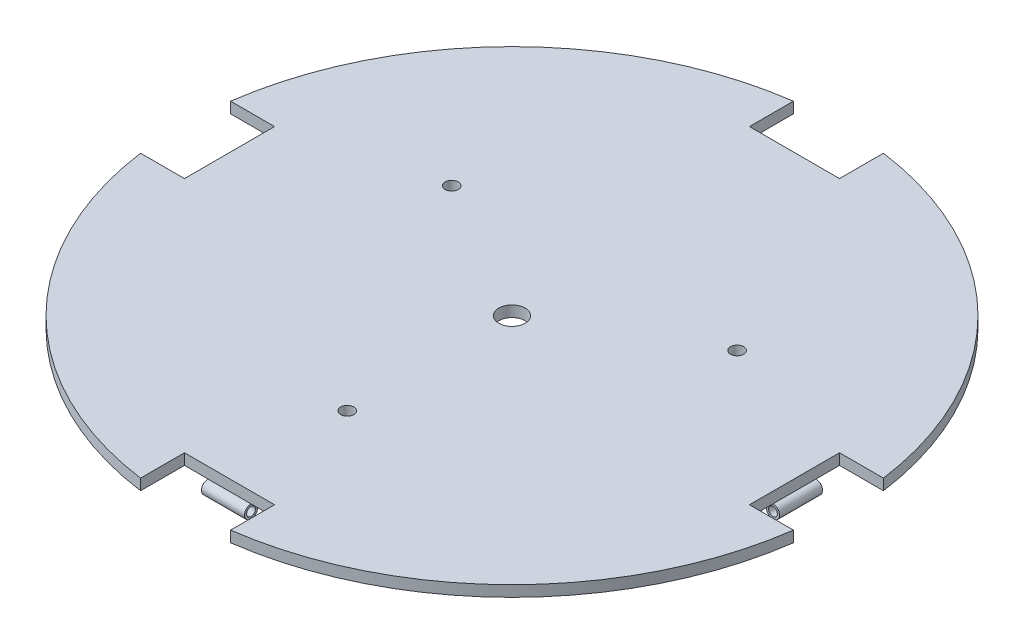
from build123d import *

# Parameters (mm, degrees)
SKETCH1_R               = 150
BOSS_EXTRUDE1_DEPTH     = 5
CUT_EXTRUDE1_DEPTH      = 213.190951739
CUT_EXTRUDE1_DEPTH_BACK = 213.190951739
SKETCH2_R               = 6
CUT_EXTRUDE2_DEPTH      = 213.190951739
CUT_EXTRUDE2_DEPTH_BACK = 213.190951739
SKETCH3_R               = 3
CUT_EXTRUDE3_DEPTH      = 213.190951739
CUT_EXTRUDE3_DEPTH_BACK = 213.190951739
SKETCH5_R               = 3
SKETCH5_R_2             = 2
BOSS_EXTRUDE2_DEPTH     = 9.8
CIRPATTERN1_COUNT       = 4


with BuildPart() as part:
    # Sketch1 → Boss-Extrude1 (new body)
    with BuildSketch(Plane(origin=(0, 0, 0), x_dir=(1, 0, 0), z_dir=(0, 1, 0))):
        with Locations(Location((0, 0, 0), (0, 0, 270))):
            Circle(SKETCH1_R)
    extrude(amount=BOSS_EXTRUDE1_DEPTH)

    # Sketch2 → Cut-Extrude1 (cut, two sides: drawn at the far end of the back side and taken through both)
    with BuildSketch(Plane(origin=(0, 5, 0), x_dir=(1, 0, 0), z_dir=(0, 1, 0)).offset(-CUT_EXTRUDE1_DEPTH_BACK)):
        with Locations(Location((0, 0, 0), (0, 0, 270))):
            Circle(SKETCH2_R)
    extrude(amount=CUT_EXTRUDE1_DEPTH + CUT_EXTRUDE1_DEPTH_BACK, mode=Mode.SUBTRACT)

    # Sketch3 → Cut-Extrude2 (cut, two sides: drawn at the far end of the back side and taken through both)
    with BuildSketch(Plane(origin=(0, 5, 0), x_dir=(1, 0, 0), z_dir=(0, 1, 0)).offset(-CUT_EXTRUDE2_DEPTH_BACK)):
        with Locations(Location((-64.951905284, 37.5, 0), (0, 0, 270))):
            Circle(SKETCH3_R)
        with Locations(Location((64.951905284, 37.5, 0), (0, 0, 270))):
            Circle(SKETCH3_R)
        with Locations(Location((0, -75, 0), (0, 0, 270))):
            Circle(SKETCH3_R)
    extrude(amount=CUT_EXTRUDE2_DEPTH + CUT_EXTRUDE2_DEPTH_BACK, mode=Mode.SUBTRACT)

    # Sketch4 → Cut-Extrude3 (cut, two sides: drawn at the far end of the back side and taken through both)
    with BuildSketch(Plane(origin=(0, 5, 0), x_dir=(1, 0, 0), z_dir=(0, 1, 0)).offset(-CUT_EXTRUDE3_DEPTH_BACK)):
        with BuildLine():
            ThreePointArc((20.5, 148.592563744), (0, 150), (-20.5, 148.592563744))
            Line((-20.5, 148.592563744), (-20.5, 128.592563744))
            Line((-20.5, 128.592563744), (20.5, 128.592563744))
            Line((20.5, 128.592563744), (20.5, 148.592563744))
        make_face()
        with BuildLine():
            ThreePointArc((-148.592563744, 20.5), (-150, 0), (-148.592563744, -20.5))
            Line((-148.592563744, -20.5), (-128.592563744, -20.5))
            Line((-128.592563744, -20.5), (-128.592563744, 20.5))
            Line((-128.592563744, 20.5), (-148.592563744, 20.5))
        make_face()
        with BuildLine():
            Line((128.592563744, -20.5), (148.592563744, -20.5))
            ThreePointArc((148.592563744, -20.5), (149.647727282, -10.274128635), (150, 0))
            ThreePointArc((150, 0), (149.647727282, 10.274128635), (148.592563744, 20.5))
            Line((148.592563744, 20.5), (128.592563744, 20.5))
            Line((128.592563744, 20.5), (128.592563744, -20.5))
        make_face()
        with BuildLine():
            Line((-20.5, -128.592563744), (-20.5, -148.592563744))
            ThreePointArc((-20.5, -148.592563744), (0, -150), (20.5, -148.592563744))
            Line((20.5, -148.592563744), (20.5, -128.592563744))
            Line((20.5, -128.592563744), (-20.5, -128.592563744))
        make_face()
    extrude(amount=CUT_EXTRUDE3_DEPTH + CUT_EXTRUDE3_DEPTH_BACK, mode=Mode.SUBTRACT)

    # Sketch5 → Boss-Extrude2 (add, symmetric)
    # profile 1 of 2: a face of its own
    with BuildSketch(Plane.XY):
        with BuildLine():
            Line((-125.592563744, 0), (-128.592563744, 0))
            ThreePointArc((-128.592563744, 0), (-126.4712434, -0.878679656), (-125.592563744, -3))
            Line((-125.592563744, -3), (-125.592563744, 0))
        make_face()
    # profile 2 of 2: a face of its own
    with BuildSketch(Plane.XY):
        with Locations((-128.592563744, -3)):
            Circle(SKETCH5_R)
        with Locations((-128.592563744, -3)):
            Circle(SKETCH5_R_2, mode=Mode.SUBTRACT)
    boss_extrude2 = extrude(amount=BOSS_EXTRUDE2_DEPTH, both=True)

    # CirPattern1: Boss-Extrude2 ×4 about axis
    cirpattern1_axis = Axis((0, 0, 0), (0, 1, 0))
    for i in range(1, CIRPATTERN1_COUNT):
        add(boss_extrude2.rotate(cirpattern1_axis, i * 360 / CIRPATTERN1_COUNT))


solid = part.part
